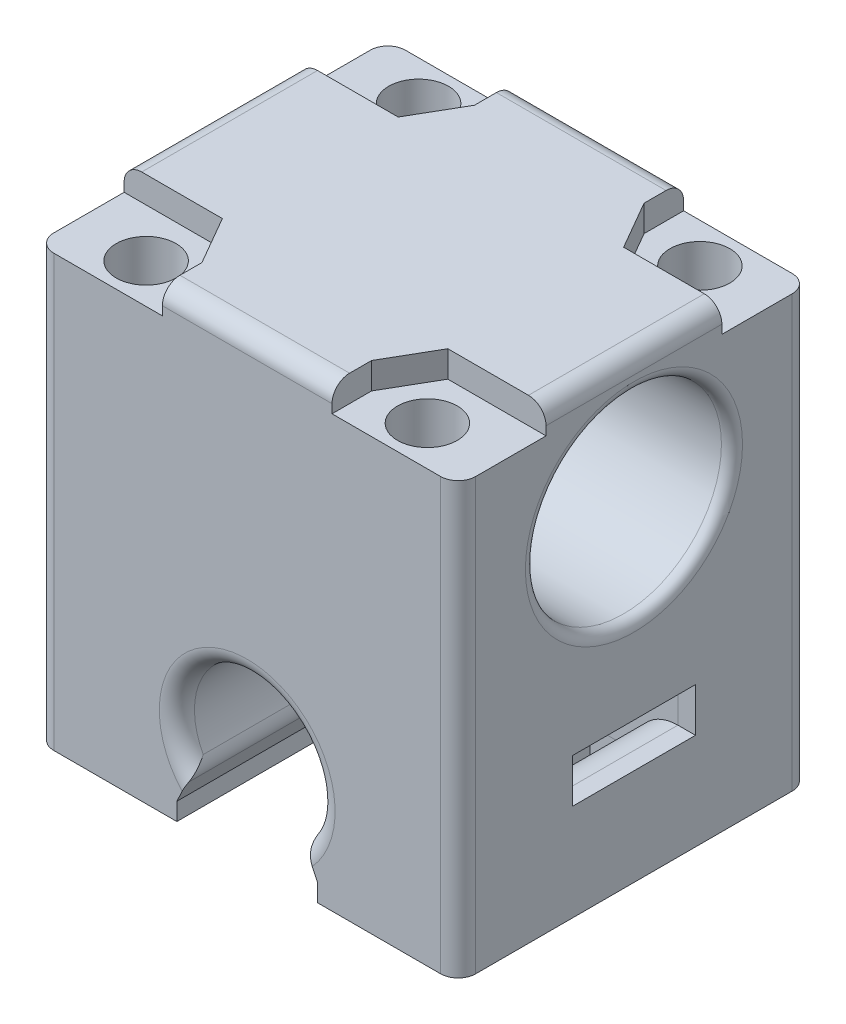
from build123d import *

# Parameters (mm, degrees)
CROQUIS1_W              = 24
CROQUIS1_H              = 19.999999388
SALIENTE_EXTRUIR1_DEPTH = 25
CORTAR_EXTRUIR1_DEPTH   = 60.75663166
CROQUIS4_R              = 1.7
CORTAR_EXTRUIR3_DEPTH   = 62.337415173
CROQUIS8_W              = 7
CROQUIS8_H              = 2.5
CORTAR_EXTRUIR7_DEPTH   = 1.5
CROQUIS3_R              = 5.575
CORTAR_EXTRUIR8_DEPTH   = 40
SALIENTE_EXTRUIR2_START = 1
CROQUIS13_W             = 8
CROQUIS13_H             = 19.999999388
CROQUIS13_R             = 1.7
CROQUIS13_W_2           = 2.5
CROQUIS13_H_2           = 7
SALIENTE_EXTRUIR2_DEPTH = 1
SALIENTE_EXTRUIR3_START = 1
CROQUIS14_W             = 8
CROQUIS14_H             = 19.999999388
CROQUIS14_R             = 1.7
CROQUIS14_W_2           = 2.5
CROQUIS14_H_2           = 7
SALIENTE_EXTRUIR3_DEPTH = 1
REDONDEO1_R             = 1
REDONDEO3_R             = 0.6


with BuildPart() as part:
    # Croquis1 → Saliente-Extruir1 (new body)
    with BuildSketch(Plane.XZ):
        with Locations((38.456466898, 14.319199476)):
            Rectangle(CROQUIS1_W, CROQUIS1_H)
    extrude(amount=-SALIENTE_EXTRUIR1_DEPTH)

    # Croquis2 → Cortar-Extruir1 (cut, through all)
    with BuildSketch(Plane.XY.offset(24.31919917)):
        with BuildLine():
            Line((34.456466898, 0), (35.224817797, 1.642788918))
            ThreePointArc((35.224817797, 1.642788918), (38.456466898, 8), (41.688116, 1.642788918))
            Line((41.688116, 1.642788918), (42.456466898, 0))
            Line((42.456466898, 0), (34.456466898, 0))
        make_face()
    extrude(amount=-CORTAR_EXTRUIR1_DEPTH, mode=Mode.SUBTRACT)

    # Croquis4 → Cortar-Extruir3 (cut, through all)
    with BuildSketch(Plane.XZ):
        with Locations(Location((30.456466898, 22.069199782, 0), (0, 0, 270))):
            Circle(CROQUIS4_R)
        with Locations(Location((46.456466898, 22.069199782, 0), (0, 0, 90))):
            Circle(CROQUIS4_R)
        with Locations(Location((46.456466898, 6.569198558, 0), (0, 0, 270))):
            Circle(CROQUIS4_R)
        with Locations(Location((30.456466898, 6.569198558, 0), (0, 0, 90))):
            Circle(CROQUIS4_R)
    extrude(amount=-CORTAR_EXTRUIR3_DEPTH, mode=Mode.SUBTRACT)

    # Cortar-Barrer2: sweep along a path in Croquis9
    with BuildLine(Plane(origin=(0, 0, 10.819199782), x_dir=(-1, 0, 0), z_dir=(0, 0, -1))) as cortar_barrer2_path:
        Line((-50.456466898, 6.999998763), (-49.456466898, 6.999998763))
        ThreePointArc((-49.456466898, 6.999998763), (-45.920932992, 5.535532669), (-44.456466898, 1.999998763))
        Line((-44.456466898, 1.999998763), (-44.456466898, -1.237e-06))
    # Croquis8 → Cortar-Barrer2 (sweep, cut)
    with BuildSketch(Plane(origin=(50.456466898, 0, 0), x_dir=(0, 0, -1), z_dir=(1, 0, 0))):
        with Locations((-14.319199782, 5.749998763)):
            Rectangle(CROQUIS8_W, CROQUIS8_H)
    cortar_barrer2 = sweep(path=cortar_barrer2_path.line, mode=Mode.SUBTRACT)

    # Simetría1: Cortar-Barrer2 across plane
    add(cortar_barrer2.mirror(Plane(origin=(38.456466898, 0, 0), x_dir=(0, 0, 1), z_dir=(1, 0, 0))), mode=Mode.SUBTRACT)

    # Croquis11 → Cortar-Extruir7 (cut)
    with BuildSketch(Plane(origin=(0, 25, 0), x_dir=(1, 0, 0), z_dir=(0, 1, 0))):
        Polygon((48.044180138, -19.319200394), (44.868753698, -19.319200394), (43.281040397, -22.069200359), (43.281040397, -24.31919917), (50.456466898, -24.31919917), (50.456466898, -19.319200394), align=None)
        Polygon((26.456466898, -24.31919917), (33.631893399, -24.31919917), (33.631893399, -22.069200359), (32.044180098, -19.319200394), (28.868753658, -19.319200394), (26.456466898, -19.319200394), align=None)
        Polygon((50.456466898, -4.319199782), (43.281040397, -4.319199782), (43.281040397, -6.569198594), (44.868753698, -9.319198558), (48.044180138, -9.319198558), (50.456466898, -9.319198558), align=None)
        Polygon((28.868753658, -9.319198558), (32.044180098, -9.319198558), (33.631893399, -6.569198594), (33.631893399, -4.319199782), (26.456466898, -4.319199782), (26.456466898, -9.319198558), align=None)
    extrude(amount=-CORTAR_EXTRUIR7_DEPTH, mode=Mode.SUBTRACT)

    # Croquis3 → Cortar-Extruir8 (cut)
    with BuildSketch(Plane(origin=(50.456466898, 0, 0), x_dir=(0, 0, -1), z_dir=(1, 0, 0))):
        with Locations((-14.31919917, 17.49999856)):
            Circle(CROQUIS3_R)
    extrude(amount=-CORTAR_EXTRUIR8_DEPTH, mode=Mode.SUBTRACT)

    # Croquis13 → Saliente-Extruir2 (add)
    with BuildSketch(Plane.XZ.offset(SALIENTE_EXTRUIR2_START)):
        with Locations((46.456466898, 14.319199476)):
            Rectangle(CROQUIS13_W, CROQUIS13_H)
        with Locations(Location((46.456466898, 22.069199782, 0), (0, 0, 270))):
            Circle(CROQUIS13_R, mode=Mode.SUBTRACT)
        with Locations(Location((46.456466898, 6.569198558, 0), (0, 0, 270))):
            Circle(CROQUIS13_R, mode=Mode.SUBTRACT)
        with Locations((45.706466898, 14.319199782)):
            Rectangle(CROQUIS13_W_2, CROQUIS13_H_2, mode=Mode.SUBTRACT)
    extrude(amount=-SALIENTE_EXTRUIR2_DEPTH)

    # Croquis14 → Saliente-Extruir3 (add)
    with BuildSketch(Plane.XZ.offset(SALIENTE_EXTRUIR3_START)):
        with Locations((30.456466898, 14.319199476)):
            Rectangle(CROQUIS14_W, CROQUIS14_H)
        with Locations(Location((30.456466898, 22.069199782, 0), (0, 0, 270))):
            Circle(CROQUIS14_R, mode=Mode.SUBTRACT)
        with Locations(Location((30.456466898, 6.569198558, 0), (0, 0, 270))):
            Circle(CROQUIS14_R, mode=Mode.SUBTRACT)
        with Locations((31.206466898, 14.319199782)):
            Rectangle(CROQUIS14_W_2, CROQUIS14_H_2, mode=Mode.SUBTRACT)
    extrude(amount=-SALIENTE_EXTRUIR3_DEPTH)

    # Redondeo1
    redondeo1_edges = [part.edges().sort_by_distance(p)[0] for p in [
        (38.456466898, 25, 24.31919917),
        (50.456466898, 11.25, 24.31919917),
        (26.456466898, 25, 14.319199476),
        (26.456466898, 11.25, 24.31919917),
        (38.456466898, 25, 4.319199782),
        (26.456466898, 11.25, 4.319199782),
        (50.456466898, 25, 14.319199476),
        (50.456466898, 11.25, 4.319199782),
        (38.456466898, 8, 4.319199782),
        (35.224817797, 1.642788918, 14.319199476),
        (41.688116, 1.642788918, 14.319199476),
        (38.456466898, 8, 24.31919917),
    ]]
    fillet(redondeo1_edges, radius=REDONDEO1_R)

    # Redondeo3
    redondeo3_edges = [part.edges().sort_by_distance(p)[0] for p in [
        (26.456466898, 17.49999856, 19.89419917),
        (50.456466898, 17.49999856, 19.89419917),
    ]]
    fillet(redondeo3_edges, radius=REDONDEO3_R)


solid = part.part
